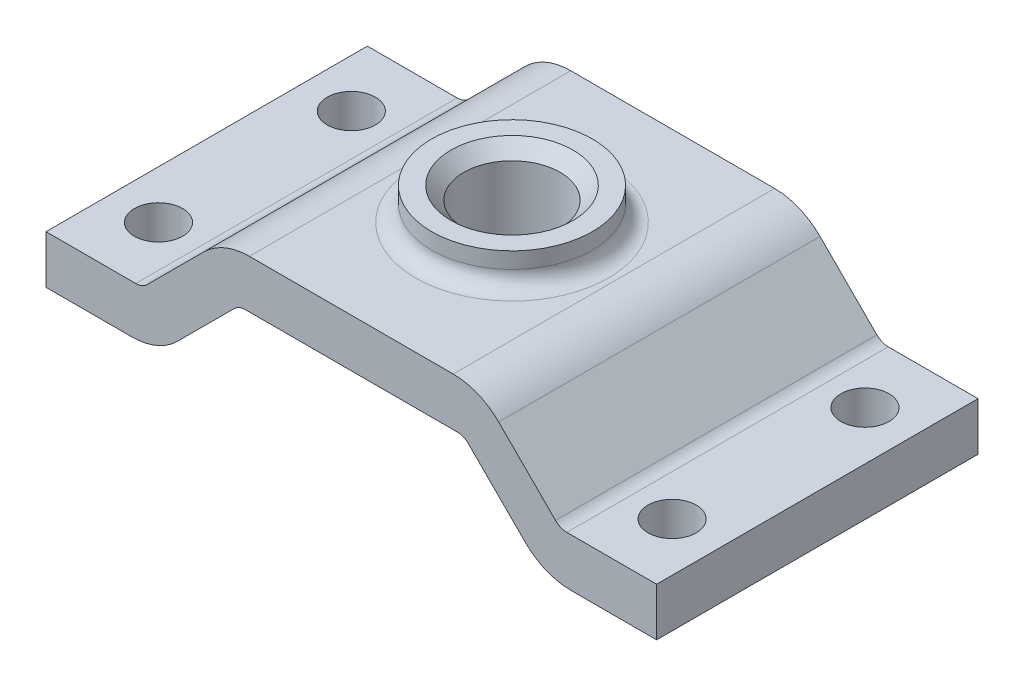
from build123d import *

# Parameters (mm, degrees)
BASE_DEPTH            = 31.75
ROUND_BOSS_DEPTH      = 6.35
ROUND_BOSS_DEPTH_BACK = 25.4
SKETCH2_R             = 15.875
SKETCH3_R             = 9.525
CENTER_HOLE_DEPTH     = 76.201267443
FILLET1_R             = 3.175
CHAMFER1_SIZE         = 2.54
SKETCH4_R             = 4.7625
RIVET_HOLES_DEPTH     = 72.701595171


with BuildPart() as part:
    # Sketch1 → Base (new, symmetric)
    with BuildSketch(Plane.XY):
        with BuildLine():
            Line((0, 0), (-20.139487758, 0))
            ThreePointArc((-20.139487758, 0), (-24.999567349, -0.966729937), (-29.119743879, -3.719743879))
            Line((-29.119743879, -3.719743879), (-40.34506403, -14.94506403))
            ThreePointArc((-40.34506403, -14.94506403), (-41.375108163, -15.633317516), (-42.590128061, -15.875))
            Line((-42.590128061, -15.875), (-60.325, -15.875))
            Line((-60.325, -15.875), (-60.325, -25.4))
            Line((-60.325, -25.4), (-43.360512242, -25.4))
            ThreePointArc((-43.360512242, -25.4), (-38.500432651, -24.433270063), (-34.380256121, -21.680256121))
            Line((-34.380256121, -21.680256121), (-23.15493597, -10.45493597))
            ThreePointArc((-23.15493597, -10.45493597), (-22.124891837, -9.766682484), (-20.909871939, -9.525))
            Line((-20.909871939, -9.525), (0, -9.525))
            Line((0, -9.525), (0, 0))
        make_face()
        with BuildLine():
            Line((20.139487758, 0), (0, 0))
            Line((0, 0), (0, -9.525))
            Line((0, -9.525), (20.909871939, -9.525))
            ThreePointArc((20.909871939, -9.525), (22.124891837, -9.766682484), (23.15493597, -10.45493597))
            Line((23.15493597, -10.45493597), (34.380256121, -21.680256121))
            ThreePointArc((34.380256121, -21.680256121), (38.500432651, -24.433270063), (43.360512242, -25.4))
            Line((43.360512242, -25.4), (60.325, -25.4))
            Line((60.325, -25.4), (60.325, -15.875))
            Line((60.325, -15.875), (42.590128061, -15.875))
            ThreePointArc((42.590128061, -15.875), (41.375108163, -15.633317516), (40.34506403, -14.94506403))
            Line((40.34506403, -14.94506403), (29.119743879, -3.719743879))
            ThreePointArc((29.119743879, -3.719743879), (24.999567349, -0.966729937), (20.139487758, 0))
        make_face()
    extrude(amount=BASE_DEPTH, both=True)

    # Sketch2 → Round Boss (add, two sides: drawn at the far end of the back side and taken through both)
    with BuildSketch(Plane(origin=(0, 0, 0), x_dir=(1, 0, 0), z_dir=(0, 1, 0)).offset(-ROUND_BOSS_DEPTH_BACK)):
        with Locations(Location((0, 0, 0), (0, 0, 270))):
            Circle(SKETCH2_R)
    extrude(amount=ROUND_BOSS_DEPTH + ROUND_BOSS_DEPTH_BACK)

    # Sketch3 → Center Hole (cut, through all)
    with BuildSketch(Plane(origin=(0, 6.35, 0), x_dir=(1, 0, 0), z_dir=(0, 1, 0))):
        with Locations(Location((0, 0, 0), (0, 0, 270))):
            Circle(SKETCH3_R)
    extrude(amount=-CENTER_HOLE_DEPTH, mode=Mode.SUBTRACT)

    # Fillet1
    fillet1_edges = [part.edges().sort_by_distance(p)[0] for p in [
        (0, 0, -15.875),
        (0, -9.525, -15.875),
    ]]
    fillet(fillet1_edges, radius=FILLET1_R)

    # Chamfer1
    chamfer1_edges = [part.edges().sort_by_distance(p)[0] for p in [
        (0, 6.35, -9.525),
    ]]
    chamfer(chamfer1_edges, length=CHAMFER1_SIZE)

    # Sketch4 → Rivet Holes (cut, through all)
    with BuildSketch(Plane(origin=(0, -15.875, 0), x_dir=(1, 0, 0), z_dir=(0, 1, 0))):
        with Locations(Location((-50.8, 19.05, 0), (0, 0, 180))):
            Circle(SKETCH4_R)
        with Locations(Location((-50.8, -19.05, 0), (0, 0, 180))):
            Circle(SKETCH4_R)
        with Locations(Location((50.690390268, -19.05, 0), (0, 0, 180))):
            Circle(SKETCH4_R)
        with Locations(Location((50.690390268, 19.05, 0), (0, 0, 180))):
            Circle(SKETCH4_R)
    extrude(amount=-RIVET_HOLES_DEPTH, mode=Mode.SUBTRACT)


solid = part.part
